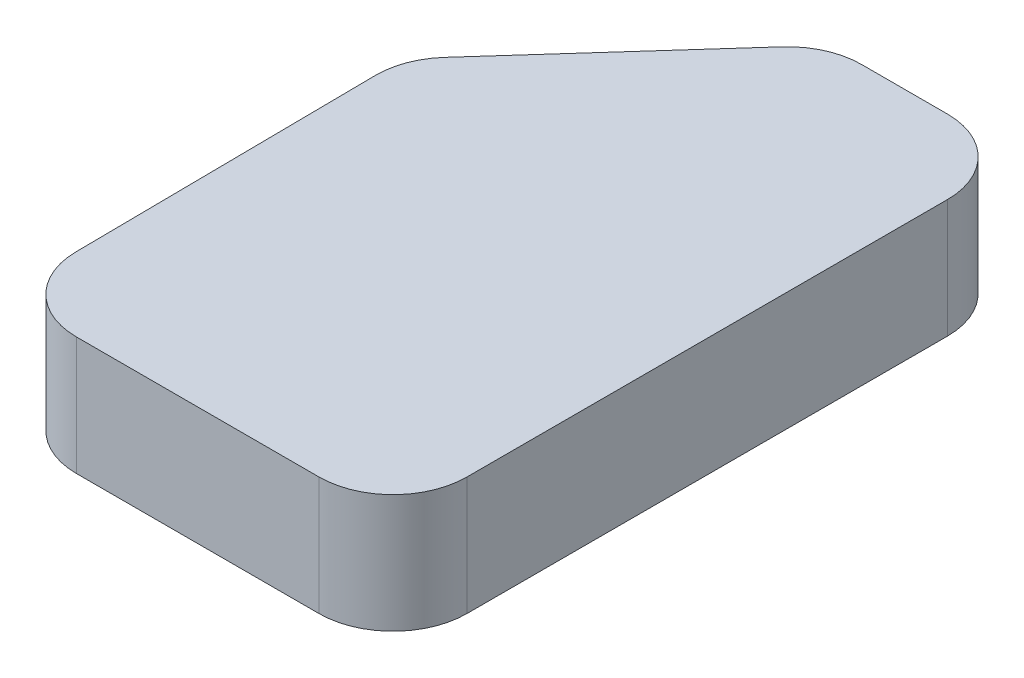
from build123d import *

# Parameters (mm, degrees)
ESQUISSE1_W             = 80
ESQUISSE1_H             = 16
BOSS_EXTRU_1_DEPTH      = 85
ENL_V_MAT_EXTRU_1_DEPTH = 118.817655723
CONG_1_R                = 10
ENL_V_MAT_EXTRU_2_DEPTH = 118.817655723
CONG_2_R                = 10


with BuildPart() as part:
    # Esquisse1 → Boss.-Extru.1 (new body)
    with BuildSketch(Plane.XY):
        with Locations((40, 8)):
            Rectangle(ESQUISSE1_W, ESQUISSE1_H)
    extrude(amount=BOSS_EXTRU_1_DEPTH)

    # Esquisse4 → Enlèv. mat.-Extru.1 (cut, through all)
    with BuildSketch(Plane(origin=(0, 16, 0), x_dir=(1, 0, 0), z_dir=(0, 1, 0))):
        with BuildLine():
            Line((0, 0), (0, -60.067381304))
            Line((0, -60.067381304), (50.91884997, -3.321412558))
            ThreePointArc((50.91884997, -3.321412558), (54.286554034, -0.868026653), (58.361730446, 0))
            Line((58.361730446, 0), (0, 0))
        make_face()
    extrude(amount=-ENL_V_MAT_EXTRU_1_DEPTH, mode=Mode.SUBTRACT)

    # Congé1
    cong_1_edges = [part.edges().sort_by_distance(p)[0] for p in [
        (0, 8, 60.067381304),
    ]]
    fillet(cong_1_edges, radius=CONG_1_R)

    # Esquisse5 → Enlèv. mat.-Extru.2 (cut, through all)
    with BuildSketch(Plane(origin=(0, 0, 0), x_dir=(-1, 0, 0), z_dir=(0, -1, 0))):
        Polygon((-27.29979965, -85), (-26.737984747, -30.269519654), (25.961948545, -37.418966658), (23.023106213, -85), align=None)
    extrude(amount=-ENL_V_MAT_EXTRU_2_DEPTH, mode=Mode.SUBTRACT)

    # Congé2
    cong_2_edges = [part.edges().sort_by_distance(p)[0] for p in [
        (80, 8, 85),
        (27.29979965, 8, 85),
        (26.737984747, 8, 30.269519654),
        (80, 8, 0),
    ]]
    fillet(cong_2_edges, radius=CONG_2_R)


solid = part.part
